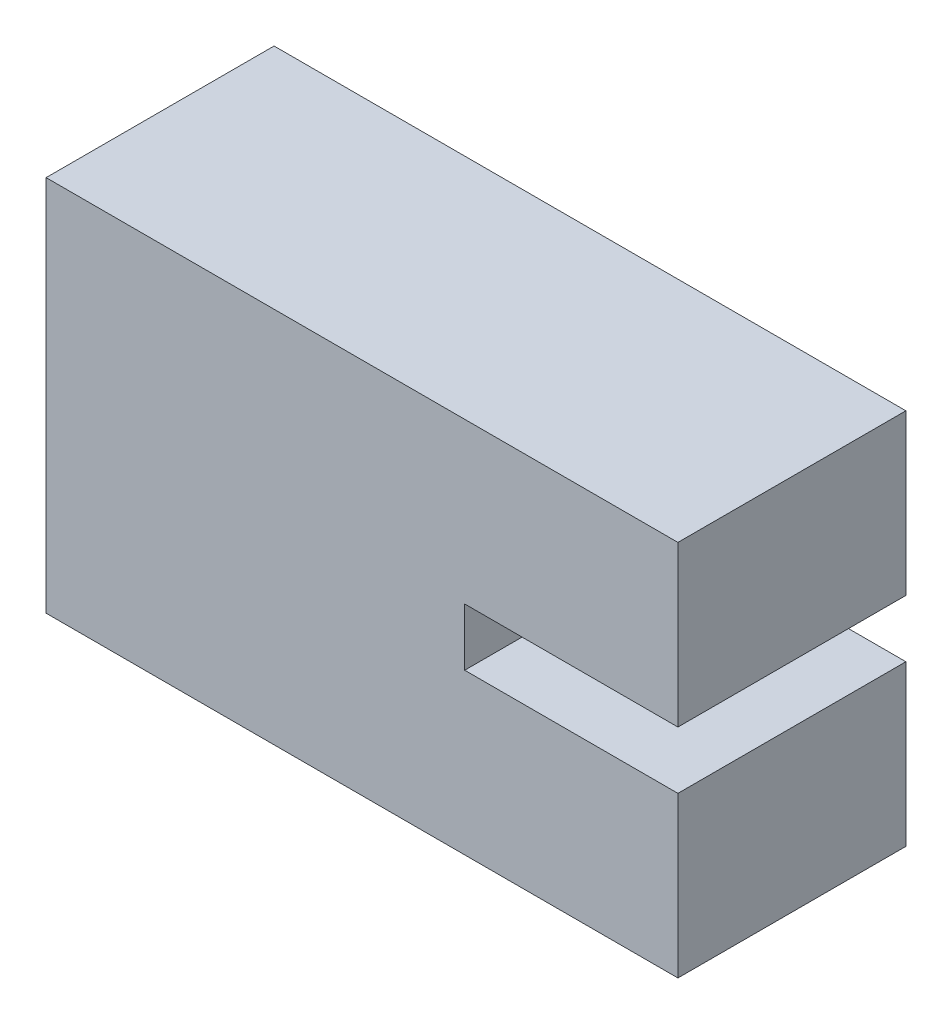
from build123d import *

# Parameters (mm, degrees)
BOSS_EXTRUDE1_DEPTH = 8.552959
SKETCH2_W           = 8.552959
SKETCH2_H           = 14.1536931
BOSS_EXTRUDE2_DEPTH = 4


with BuildPart() as part:
    # Sketch1 → Boss-Extrude1 (new body)
    with BuildSketch(Plane.XY):
        Polygon((0, 0), (0, 14.1536931), (19.704590583, 14.1536931), (19.704590583, 8.1536931), (11.704590583, 8.1536931), (11.704590583, 6), (19.704590583, 6), (19.704590583, 0), align=None)
    extrude(amount=BOSS_EXTRUDE1_DEPTH)

    # Sketch2 → Boss-Extrude2 (add)
    with BuildSketch(Plane.ZY):
        with Locations((4.2764795, 7.07684655)):
            Rectangle(SKETCH2_W, SKETCH2_H)
    extrude(amount=BOSS_EXTRUDE2_DEPTH)


solid = part.part
